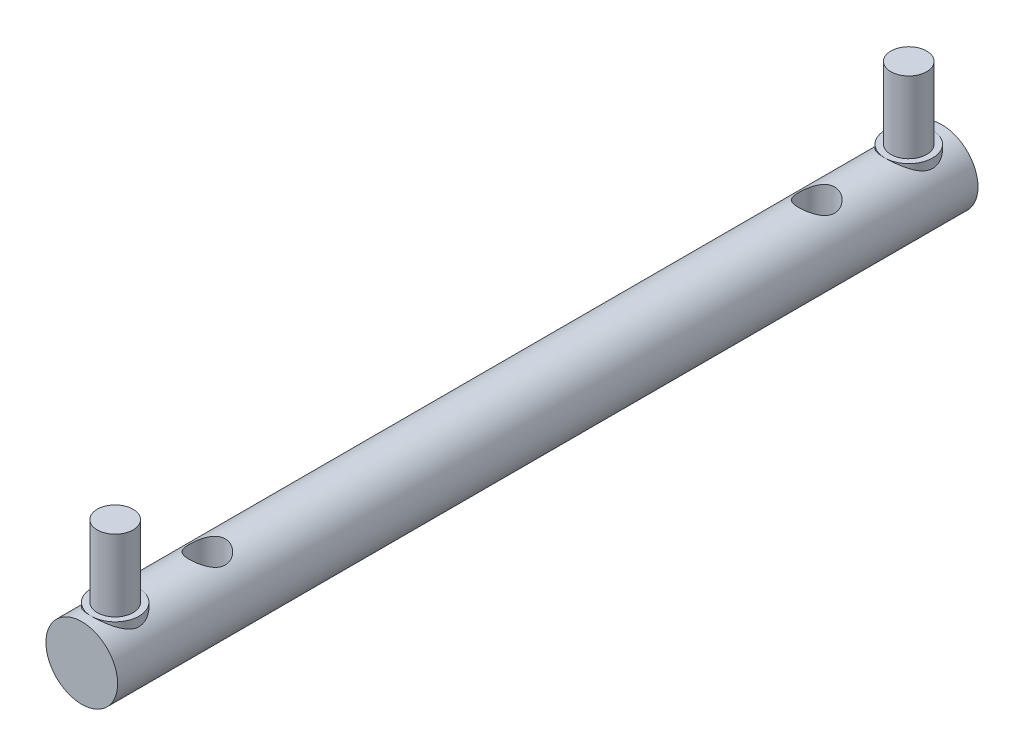
from build123d import *
from build123d.topology import SkipClean

# Parameters (mm, degrees)
SKETCH1_R           = 15
BOSS_EXTRUDE1_DEPTH = 360
SKETCH2_R           = 7.5
BOSS_EXTRUDE2_DEPTH = 10
BOSS_EXTRUDE3_START = 30
SKETCH3_R           = 7.5
BOSS_EXTRUDE3_DEPTH = 30
SKETCH8_R           = 10
BOSS_EXTRUDE4_DEPTH = 10
SKETCH9_R           = 7.5
CUT_EXTRUDE1_DEPTH  = 362.559123908


with BuildPart() as part:
    # Sketch1 → Boss-Extrude1 (new body)
    with BuildSketch(Plane.XY):
        with Locations(Location((0, 0, 0), (0, 0, 180))):
            Circle(SKETCH1_R)
    extrude(amount=BOSS_EXTRUDE1_DEPTH)

    # Sketch2 → Boss-Extrude2 (add)
    with BuildSketch(Plane(origin=(0, 15, 0), x_dir=(1, 0, 0), z_dir=(0, 1, 0))):
        with Locations((0, -13.965)):
            Circle(SKETCH2_R)
        with Locations((0, -346.035)):
            Circle(SKETCH2_R)
    extrude(amount=-BOSS_EXTRUDE2_DEPTH)

    # Sketch3 → Boss-Extrude3 (add)
    with SkipClean():  # the faces are left unmerged after this step: merging them gives an invalid solid
        with BuildSketch(Plane(origin=(0, 15, 0), x_dir=(1, 0, 0), z_dir=(0, 1, 0)).offset(BOSS_EXTRUDE3_START)):
            with Locations(Location((0, -346.035, 0), (0, 0, 270))):
                Circle(SKETCH3_R)
            with Locations(Location((0, -13.965, 0), (0, 0, 270))):
                Circle(SKETCH3_R)
        extrude(amount=-BOSS_EXTRUDE3_DEPTH)

    # Sketch8 → Boss-Extrude4 (add)
    with SkipClean():  # the faces are left unmerged after this step: merging them gives an invalid solid
        with BuildSketch(Plane(origin=(0, 15, 0), x_dir=(1, 0, 0), z_dir=(0, 1, 0))):
            with Locations((0, -13.965)):
                Circle(SKETCH8_R)
            with Locations((0, -346.035)):
                Circle(SKETCH8_R)
        extrude(amount=-BOSS_EXTRUDE4_DEPTH)

    # Sketch9 → Cut-Extrude1 (cut, through all)
    with SkipClean():  # the faces are left unmerged after this step: merging them gives an invalid solid
        with BuildSketch(Plane(origin=(0, 15, 0), x_dir=(1, 0, 0), z_dir=(0, 1, 0))):
            with Locations(Location((0, -52.47, 0), (0, 0, 270))):
                Circle(SKETCH9_R)
            with Locations(Location((0, -307.47, 0), (0, 0, 270))):
                Circle(SKETCH9_R)
        extrude(amount=-CUT_EXTRUDE1_DEPTH, mode=Mode.SUBTRACT)


solid = part.part
